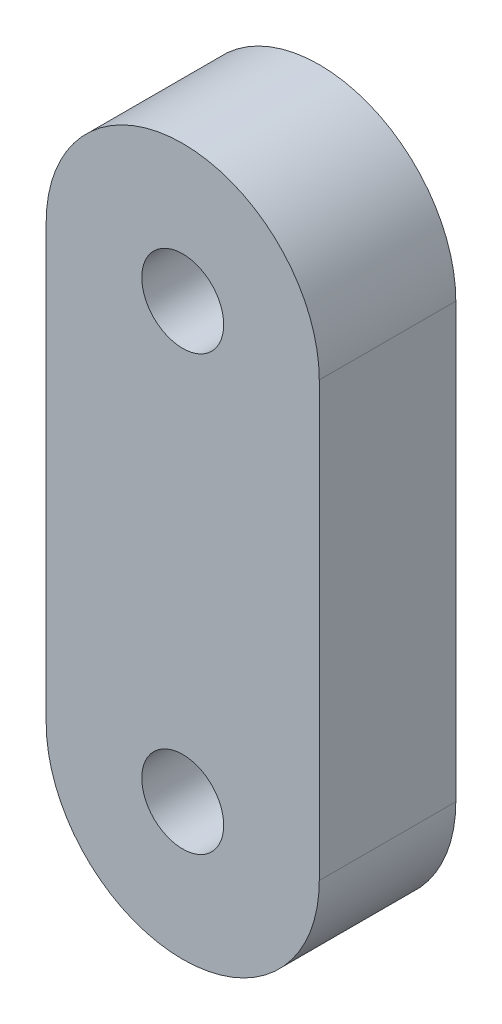
from build123d import *

# Parameters (mm, degrees)
SKETCH_1_R      = 1.2
EXTRUDE_1_DEPTH = 4


with BuildPart() as part:
    # 草图1 → 凸台-拉伸1 (new body)
    with BuildSketch(Plane.XY):
        with BuildLine():
            Line((-4, -6.35), (-4, 6.35))
            ThreePointArc((-4, 6.35), (0, 10.35), (4, 6.35))
            Line((4, 6.35), (4, -6.35))
            ThreePointArc((4, -6.35), (0, -10.35), (-4, -6.35))
        make_face()
        with Locations((0, 6.35)):
            Circle(SKETCH_1_R, mode=Mode.SUBTRACT)
        with Locations((0, -6.35)):
            Circle(SKETCH_1_R, mode=Mode.SUBTRACT)
    extrude(amount=EXTRUDE_1_DEPTH)


solid = part.part
